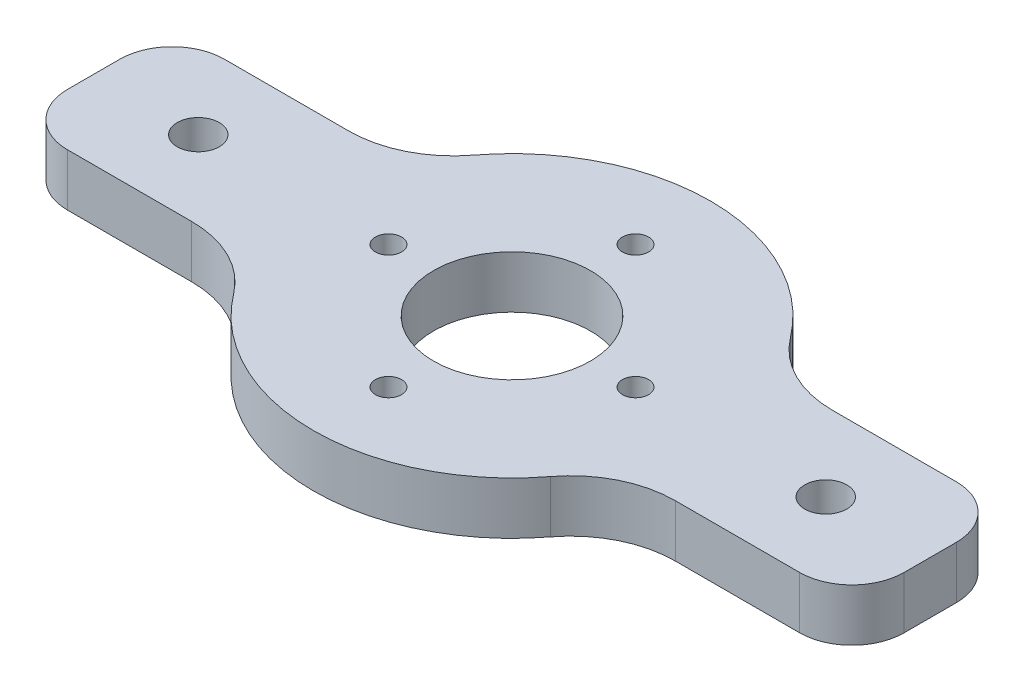
from build123d import *

# Parameters (mm, degrees)
SKETCH1_R           = 1.5875
SKETCH1_R_2         = 2.5527
BOSS_EXTRUDE2_DEPTH = 6.35


with BuildPart() as part:
    # Sketch1 → Boss-Extrude2 (new body)
    # profile 1 of 10: a face of its own
    with BuildSketch(Plane(origin=(0, 0, 0), x_dir=(1, 0, 0), z_dir=(0, 1, 0))):
        with BuildLine():
            Line((2.2e-08, 9.525), (-22.170504618, 9.525))
            ThreePointArc((-22.170504618, 9.525), (-24.13, 0), (-22.170504618, -9.525))
            Line((-22.170504618, -9.525), (4.3e-08, -9.525))
            ThreePointArc((4.3e-08, -9.525), (-9.525, -1.1e-08), (2.2e-08, 9.525))
        make_face()
        with Locations(Location((-15, 0, 0), (0, 0, 270))):
            Circle(SKETCH1_R, mode=Mode.SUBTRACT)
    # profile 2 of 10: a face of its own
    with BuildSketch(Plane(origin=(0, 0, 0), x_dir=(1, 0, 0), z_dir=(0, 1, 0))):
        with BuildLine():
            Line((22.170504618, 9.525), (2.2e-08, 9.525))
            ThreePointArc((2.2e-08, 9.525), (6.735192099, 6.735192083), (9.525, 0))
            ThreePointArc((9.525, 0), (6.735192106, -6.735192076), (4.3e-08, -9.525))
            Line((4.3e-08, -9.525), (22.170504618, -9.525))
            ThreePointArc((22.170504618, -9.525), (23.635049994, -4.86223321), (24.13, 0))
            ThreePointArc((24.13, 0), (23.635049994, 4.86223321), (22.170504618, 9.525))
        make_face()
        with Locations(Location((15, 0, 0), (0, 0, 270))):
            Circle(SKETCH1_R, mode=Mode.SUBTRACT)
    # profile 3 of 10: a face of its own
    with BuildSketch(Plane(origin=(0, 0, 0), x_dir=(1, 0, 0), z_dir=(0, 1, 0))):
        with BuildLine():
            Line((4.3e-08, -9.525), (-22.170504618, -9.525))
            ThreePointArc((-22.170504618, -9.525), (-20.858463978, -12.131833353), (-19.241313721, -14.561206897))
            ThreePointArc((-19.241313721, -14.561206897), (0, -24.13), (19.241313721, -14.561206897))
            ThreePointArc((19.241313721, -14.561206897), (20.858463978, -12.131833353), (22.170504618, -9.525))
            Line((22.170504618, -9.525), (4.3e-08, -9.525))
        make_face()
        with Locations(Location((0, -15, 0), (0, 0, 270))):
            Circle(SKETCH1_R, mode=Mode.SUBTRACT)
    # profile 4 of 10: a face of its own
    with BuildSketch(Plane(origin=(0, 0, 0), x_dir=(1, 0, 0), z_dir=(0, 1, 0))):
        with BuildLine():
            ThreePointArc((-19.241313721, 14.561206897), (-20.858463978, 12.131833353), (-22.170504618, 9.525))
            Line((-22.170504618, 9.525), (2.2e-08, 9.525))
            Line((2.2e-08, 9.525), (22.170504618, 9.525))
            ThreePointArc((22.170504618, 9.525), (20.858463978, 12.131833353), (19.241313721, 14.561206897))
            ThreePointArc((19.241313721, 14.561206897), (0, 24.13), (-19.241313721, 14.561206897))
        make_face()
        with Locations(Location((0, 15, 0), (0, 0, 270))):
            Circle(SKETCH1_R, mode=Mode.SUBTRACT)
    # profile 5 of 10: a face of its own
    with BuildSketch(Plane(origin=(0, 0, 0), x_dir=(1, 0, 0), z_dir=(0, 1, 0))):
        with BuildLine():
            Line((-29.368320943, 9.525), (-44.45, 9.525))
            ThreePointArc((-44.45, 9.525), (-48.940128061, 7.665128061), (-50.8, 3.175))
            Line((-50.8, 3.175), (-50.8, -3.175))
            ThreePointArc((-50.8, -3.175), (-48.940128061, -7.665128061), (-44.45, -9.525))
            Line((-44.45, -9.525), (-29.368320943, -9.525))
            Line((-29.368320943, -9.525), (-22.170504618, -9.525))
            ThreePointArc((-22.170504618, -9.525), (-24.13, 0), (-22.170504618, 9.525))
            Line((-22.170504618, 9.525), (-29.368320943, 9.525))
        make_face()
        with Locations(Location((-38.1, 0, 0), (0, 0, 270))):
            Circle(SKETCH1_R_2, mode=Mode.SUBTRACT)
    # profile 6 of 10: a face of its own
    with BuildSketch(Plane(origin=(0, 0, 0), x_dir=(1, 0, 0), z_dir=(0, 1, 0))):
        with BuildLine():
            Line((29.368320943, 9.525), (22.170504618, 9.525))
            ThreePointArc((22.170504618, 9.525), (23.635049994, 4.86223321), (24.13, 0))
            ThreePointArc((24.13, 0), (23.635049994, -4.86223321), (22.170504618, -9.525))
            Line((22.170504618, -9.525), (29.368320943, -9.525))
            Line((29.368320943, -9.525), (44.45, -9.525))
            ThreePointArc((44.45, -9.525), (48.940128061, -7.665128061), (50.8, -3.175))
            Line((50.8, -3.175), (50.8, 3.175))
            ThreePointArc((50.8, 3.175), (48.940128061, 7.665128061), (44.45, 9.525))
            Line((44.45, 9.525), (29.368320943, 9.525))
        make_face()
        with Locations(Location((38.1, 0, 0), (0, 0, 270))):
            Circle(SKETCH1_R_2, mode=Mode.SUBTRACT)
    # profile 7 of 10: a face of its own
    with BuildSketch(Plane(origin=(0, 0, 0), x_dir=(1, 0, 0), z_dir=(0, 1, 0))):
        with BuildLine():
            ThreePointArc((-19.241313721, 14.561206897), (-23.713242359, 10.853540718), (-29.368320943, 9.525))
            Line((-29.368320943, 9.525), (-22.170504618, 9.525))
            ThreePointArc((-22.170504618, 9.525), (-20.858463978, 12.131833353), (-19.241313721, 14.561206897))
        make_face()
    # profile 8 of 10: a face of its own
    with BuildSketch(Plane(origin=(0, 0, 0), x_dir=(1, 0, 0), z_dir=(0, 1, 0))):
        with BuildLine():
            ThreePointArc((-19.241313721, -14.561206897), (-20.858463978, -12.131833353), (-22.170504618, -9.525))
            Line((-22.170504618, -9.525), (-29.368320943, -9.525))
            ThreePointArc((-29.368320943, -9.525), (-23.713242359, -10.853540718), (-19.241313721, -14.561206897))
        make_face()
    # profile 9 of 10: a face of its own
    with BuildSketch(Plane(origin=(0, 0, 0), x_dir=(1, 0, 0), z_dir=(0, 1, 0))):
        with BuildLine():
            ThreePointArc((29.368320943, 9.525), (23.713242359, 10.853540718), (19.241313721, 14.561206897))
            ThreePointArc((19.241313721, 14.561206897), (20.858463978, 12.131833353), (22.170504618, 9.525))
            Line((22.170504618, 9.525), (29.368320943, 9.525))
        make_face()
    # profile 10 of 10: a face of its own
    with BuildSketch(Plane(origin=(0, 0, 0), x_dir=(1, 0, 0), z_dir=(0, 1, 0))):
        with BuildLine():
            Line((29.368320943, -9.525), (22.170504618, -9.525))
            ThreePointArc((22.170504618, -9.525), (20.858463978, -12.131833353), (19.241313721, -14.561206897))
            ThreePointArc((19.241313721, -14.561206897), (23.713242359, -10.853540718), (29.368320943, -9.525))
        make_face()
    extrude(amount=BOSS_EXTRUDE2_DEPTH)


solid = part.part
